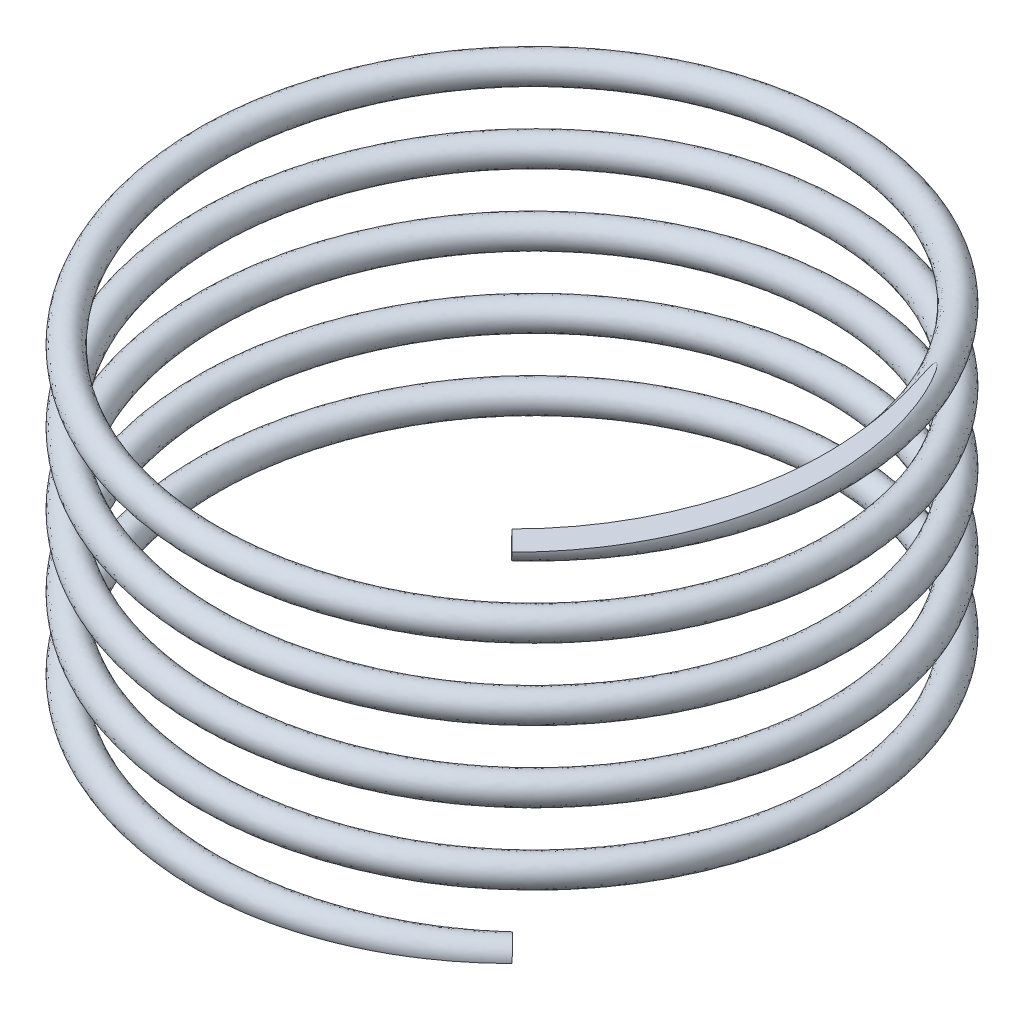
from build123d import *

# Parameters (mm, degrees)
SWEEP1_PITCH            = 2
SWEEP1_HEIGHT           = 10
SWEEP1_RADIUS           = 8.85
SWEEP1_START_ANGLE      = 135
SKETCH2_R               = 0.4
CUT_EXTRUDE1_DEPTH      = 17.711663711
CUT_EXTRUDE1_DEPTH_BACK = 17.711663711
SKETCH3_OUTSIDE_W       = 26.16
SKETCH3_OUTSIDE_H       = 18.46
SKETCH3_OUTSIDE_W_2     = 19
SKETCH3_OUTSIDE_H_2     = 10


with BuildPart() as part:
    # Sweep1: sweep along a helix
    with BuildLine() as sweep1_path:
        add(Helix(SWEEP1_PITCH, SWEEP1_HEIGHT, SWEEP1_RADIUS, center=(0, 0, 0), direction=(0, -1, 0), lefthand=True, mode=Mode.PRIVATE).rotate(Axis((0, 0, 0), (0, -1, 0)), SWEEP1_START_ANGLE))
    # Sketch2 → Sweep1 (sweep)
    with BuildSketch(Plane(origin=(6.257895014, 0, 6.257895014), x_dir=(-0.7074264414774916, -0.05554081246338724, -0.7046013398010256), z_dir=(0.7066498533636917, -0.03594397699397501, -0.7066498533636938))):
        Circle(SKETCH2_R)
    sweep(path=sweep1_path.line, is_frenet=True)

    # Sketch3 outside → Cut-Extrude1 (cut, two sides: drawn at the far end of the back side and taken through both)
    with BuildSketch(Plane(origin=(0, 0, 0), x_dir=(0, 0, -1), z_dir=(1, 0, 0)).offset(-CUT_EXTRUDE1_DEPTH_BACK)):
        with Locations((0, -5)):
            Rectangle(SKETCH3_OUTSIDE_W, SKETCH3_OUTSIDE_H)
        with Locations((0, -5)):
            Rectangle(SKETCH3_OUTSIDE_W_2, SKETCH3_OUTSIDE_H_2, mode=Mode.SUBTRACT)
    extrude(amount=CUT_EXTRUDE1_DEPTH + CUT_EXTRUDE1_DEPTH_BACK, mode=Mode.SUBTRACT)


solid = part.part
